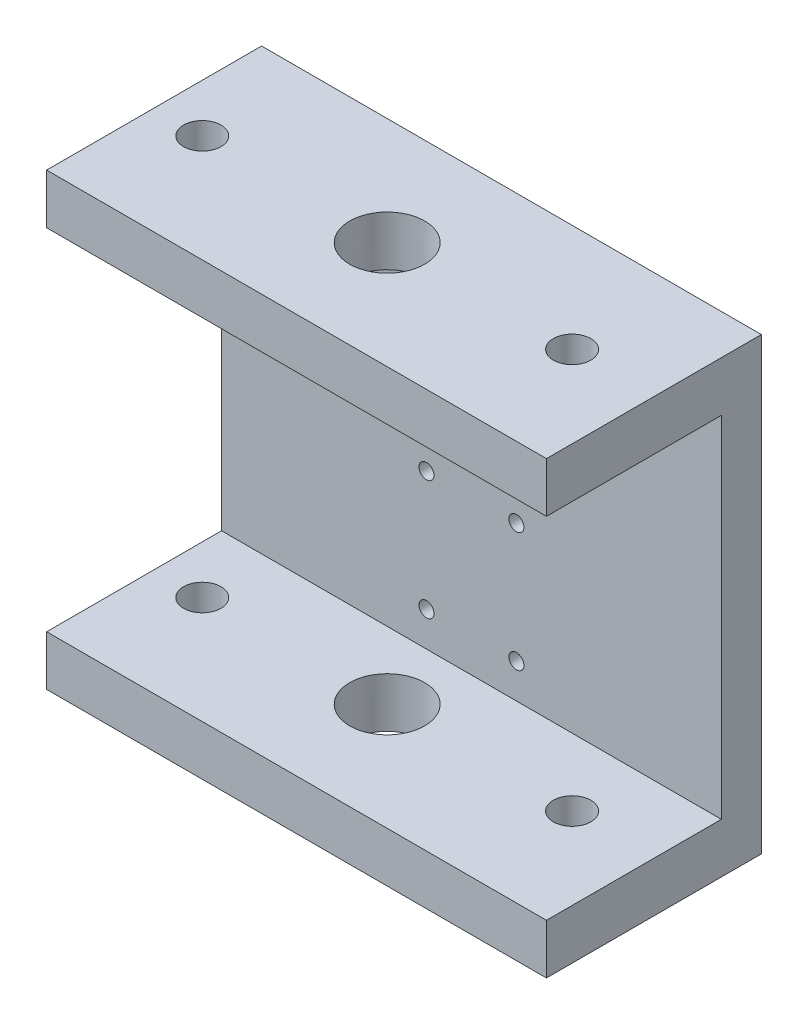
from build123d import *

# Parameters (mm, degrees)
SKETCH2_W           = 100
SKETCH2_H           = 90
SKETCH2_R           = 1.5
BOSS_EXTRUDE1_DEPTH = 8
SKETCH5_W           = 100
SKETCH5_H           = 10
BOSS_EXTRUDE2_DEPTH = 35
SKETCH7_R           = 7.5
SKETCH7_R_2         = 3.75
CUT_EXTRUDE2_DEPTH  = 290


with BuildPart() as part:
    # Sketch2 → Boss-Extrude1 (new body)
    with BuildSketch(Plane.XY):
        Rectangle(SKETCH2_W, SKETCH2_H)
        with Locations(Location((-9, -4.165902831, 0), (0, 0, 180))):
            Circle(SKETCH2_R, mode=Mode.SUBTRACT)
        with Locations(Location((9, -28.094631071, 0), (0, 0, 180))):
            Circle(SKETCH2_R, mode=Mode.SUBTRACT)
        with Locations((9, -4.165902831)):
            Circle(SKETCH2_R, mode=Mode.SUBTRACT)
        with Locations((-9, -28.094631071)):
            Circle(SKETCH2_R, mode=Mode.SUBTRACT)
        with Locations(Location((-9, 28.094631071, 0), (0, 0, 180))):
            Circle(SKETCH2_R, mode=Mode.SUBTRACT)
        with Locations((9, 28.094631071)):
            Circle(SKETCH2_R, mode=Mode.SUBTRACT)
        with Locations(Location((9, 4.165902831, 0), (0, 0, 180))):
            Circle(SKETCH2_R, mode=Mode.SUBTRACT)
        with Locations((-9, 4.165902831)):
            Circle(SKETCH2_R, mode=Mode.SUBTRACT)
    extrude(amount=BOSS_EXTRUDE1_DEPTH)

    # Sketch5 → Boss-Extrude2 (add)
    with BuildSketch(Plane.XY.offset(8)):
        with Locations((0, 40)):
            Rectangle(SKETCH5_W, SKETCH5_H)
        with Locations((0, -40)):
            Rectangle(SKETCH5_W, SKETCH5_H)
    extrude(amount=BOSS_EXTRUDE2_DEPTH)

    # Sketch7 → Cut-Extrude2 (cut)
    with BuildSketch(Plane(origin=(0, 45, 0), x_dir=(1, 0, 0), z_dir=(0, 1, 0))):
        with Locations(Location((-3.365, -21.5, 0), (0, 0, 270))):
            Circle(SKETCH7_R)
        with Locations(Location((-40.365, -21.5, 0), (0, 0, 270))):
            Circle(SKETCH7_R_2)
        with Locations(Location((33.635, -21.5, 0), (0, 0, 270))):
            Circle(SKETCH7_R_2)
    extrude(amount=-CUT_EXTRUDE2_DEPTH, mode=Mode.SUBTRACT)


solid = part.part
